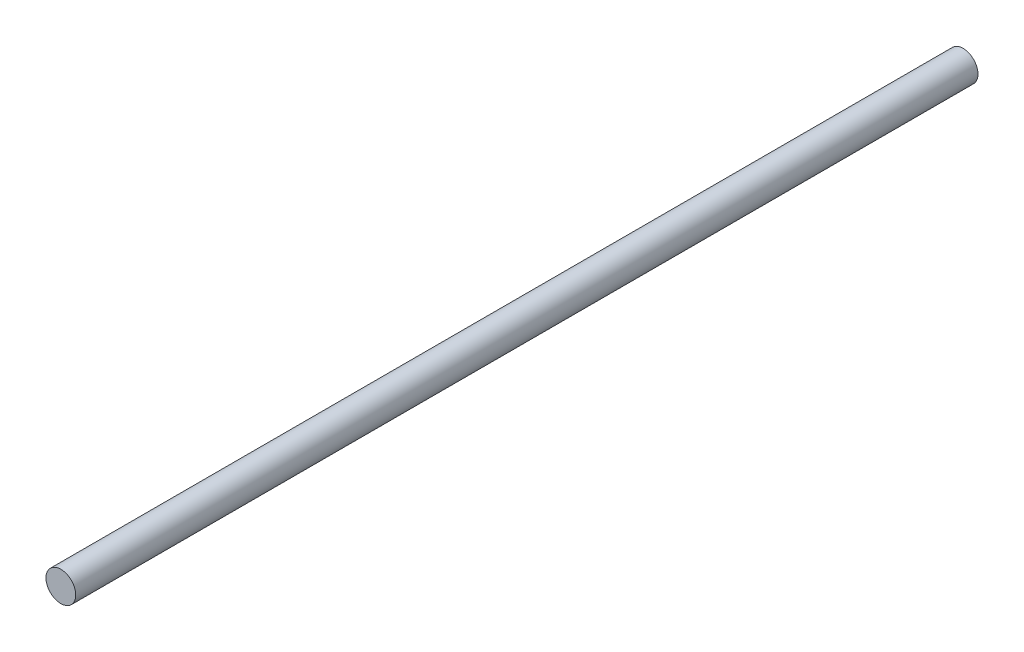
from build123d import *

# Parameters (mm, degrees)
SKETCH1_R           = 5
BOSS_EXTRUDE1_DEPTH = 303


with BuildPart() as part:
    # Sketch1 → Boss-Extrude1 (new body)
    with BuildSketch(Plane.XY):
        Circle(SKETCH1_R)
    extrude(amount=BOSS_EXTRUDE1_DEPTH)


solid = part.part
